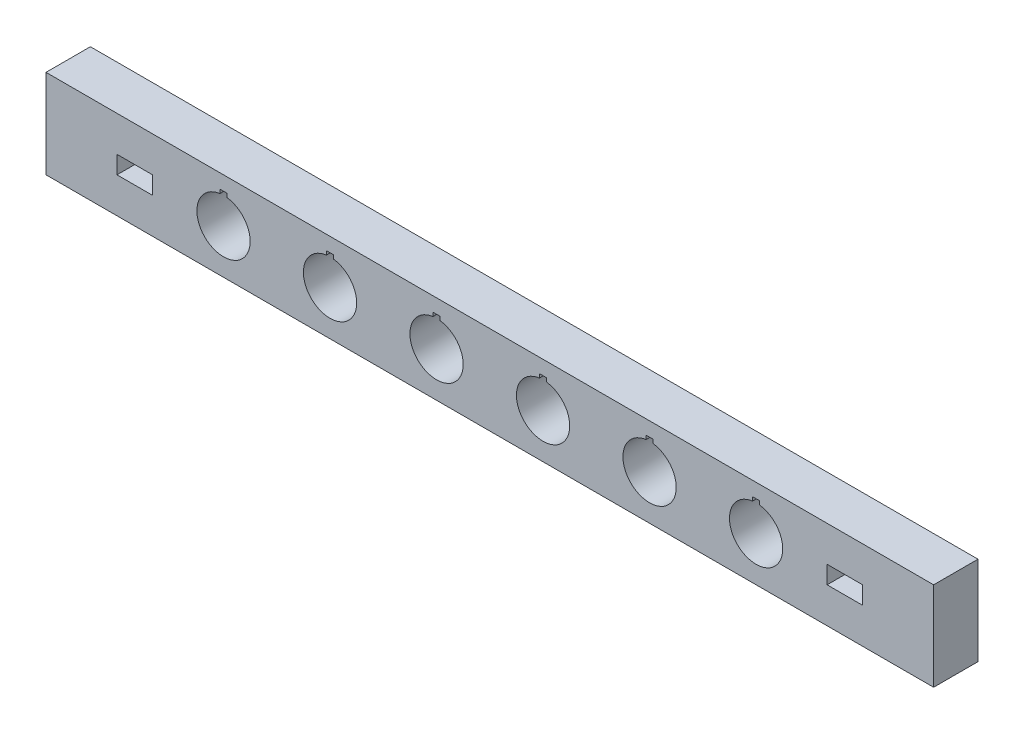
from build123d import *

# Parameters (mm, degrees)
SKETCH1_W           = 900
SKETCH1_H           = 100
BOSS_EXTRUDE1_DEPTH = 50
SKETCH2_W           = 40
SKETCH2_H           = 20
CUT_EXTRUDE1_DEPTH  = 50
SKETCH3_W           = 50
SKETCH3_H           = 50
BOSS_EXTRUDE2_DEPTH = 100


with BuildPart() as part:
    # Sketch1 → Boss-Extrude1 (new body)
    with BuildSketch(Plane.XY):
        Rectangle(SKETCH1_W, SKETCH1_H)
    extrude(amount=BOSS_EXTRUDE1_DEPTH)

    # Sketch2 → Cut-Extrude1 (cut)
    with BuildSketch(Plane.XY.offset(50)):
        with Locations((-400, 0)):
            Rectangle(SKETCH2_W, SKETCH2_H)
        with BuildLine():
            Line((-180, 34), (-184, 34))
            Line((-184, 34), (-184, 29.732137495))
            ThreePointArc((-184, 29.732137495), (-180, -30), (-176, 29.732137495))
            Line((-176, 29.732137495), (-176, 34))
            Line((-176, 34), (-180, 34))
        make_face()
        with Locations((400, 0)):
            Rectangle(SKETCH2_W, SKETCH2_H)
        with BuildLine():
            Line((-300, 34), (-296, 34))
            Line((-296, 34), (-296, 29.732137495))
            ThreePointArc((-296, 29.732137495), (-300, -30), (-304, 29.732137495))
            Line((-304, 29.732137495), (-304, 34))
            Line((-304, 34), (-300, 34))
        make_face()
        with BuildLine():
            Line((-60, 34), (-64, 34))
            Line((-64, 34), (-64, 29.732137495))
            ThreePointArc((-64, 29.732137495), (-60, -30), (-56, 29.732137495))
            Line((-56, 29.732137495), (-56, 34))
            Line((-56, 34), (-60, 34))
        make_face()
        with BuildLine():
            Line((60, 34), (56, 34))
            Line((56, 34), (56, 29.732137495))
            ThreePointArc((56, 29.732137495), (60, -30), (64, 29.732137495))
            Line((64, 29.732137495), (64, 34))
            Line((64, 34), (60, 34))
        make_face()
        with BuildLine():
            Line((180, 34), (176, 34))
            Line((176, 34), (176, 29.732137495))
            ThreePointArc((176, 29.732137495), (180, -30), (184, 29.732137495))
            Line((184, 29.732137495), (184, 34))
            Line((184, 34), (180, 34))
        make_face()
        with BuildLine():
            Line((300, 34), (296, 34))
            Line((296, 34), (296, 29.732137495))
            ThreePointArc((296, 29.732137495), (300, -30), (304, 29.732137495))
            Line((304, 29.732137495), (304, 34))
            Line((304, 34), (300, 34))
        make_face()
    extrude(amount=-CUT_EXTRUDE1_DEPTH, mode=Mode.SUBTRACT)

    # Sketch3 → Boss-Extrude2 (add)
    with BuildSketch(Plane(origin=(0, 50, 0), x_dir=(1, 0, 0), z_dir=(0, 1, 0))):
        with Locations((475, -25)):
            Rectangle(SKETCH3_W, SKETCH3_H)
        with Locations((-475, -25)):
            Rectangle(SKETCH3_W, SKETCH3_H)
    extrude(amount=-BOSS_EXTRUDE2_DEPTH)


solid = part.part
